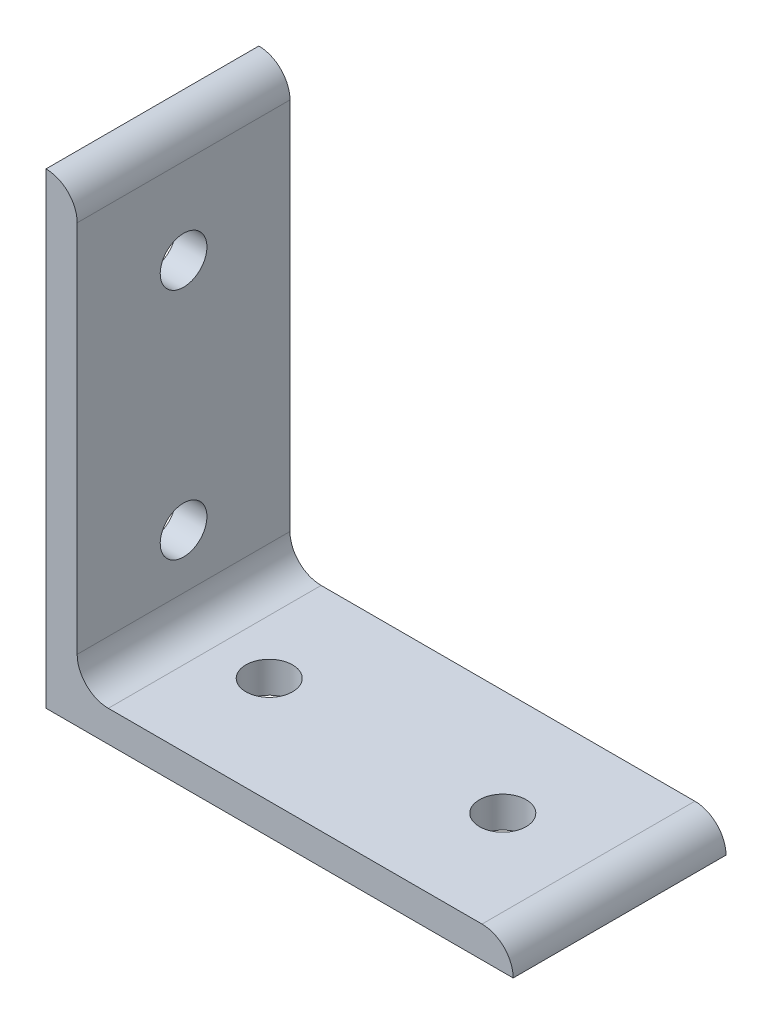
from build123d import *

# Parameters (mm, degrees)
BOSS_EXTRUDE1_DEPTH = 20.5
SKETCH2_R           = 4.5
CUT_EXTRUDE1_DEPTH  = 129.919548556
SKETCH3_R           = 4.5
CUT_EXTRUDE2_DEPTH  = 129.919548556


with BuildPart() as part:
    # Sketch1 → Boss-Extrude1 (new, symmetric)
    with BuildSketch(Plane.XY):
        with BuildLine():
            Line((0, 0), (0, 90))
            ThreePointArc((0, 90), (4.242640687, 88.242640687), (6, 84))
            Line((6, 84), (6, 12))
            ThreePointArc((6, 12), (7.757359313, 7.757359313), (12, 6))
            Line((12, 6), (84, 6))
            ThreePointArc((84, 6), (88.242640687, 4.242640687), (90, 0))
            Line((90, 0), (0, 0))
        make_face()
    extrude(amount=BOSS_EXTRUDE1_DEPTH, both=True)

    # Sketch2 → Cut-Extrude1 (cut, through all)
    with BuildSketch(Plane(origin=(0, 0, 0), x_dir=(1, 0, 0), z_dir=(0, 1, 0))):
        with Locations(Location((22.5, 0, 0), (0, 0, 90))):
            Circle(SKETCH2_R)
        with Locations(Location((67.5, 0, 0), (0, 0, 90))):
            Circle(SKETCH2_R)
    extrude(amount=CUT_EXTRUDE1_DEPTH, mode=Mode.SUBTRACT)

    # Sketch3 → Cut-Extrude2 (cut, through all)
    with BuildSketch(Plane(origin=(0, 0, 0), x_dir=(0, 0, -1), z_dir=(1, 0, 0))):
        with Locations(Location((0, 22.5, 0), (0, 0, 270))):
            Circle(SKETCH3_R)
        with Locations(Location((0, 67.5, 0), (0, 0, 270))):
            Circle(SKETCH3_R)
    extrude(amount=CUT_EXTRUDE2_DEPTH, mode=Mode.SUBTRACT)


solid = part.part
